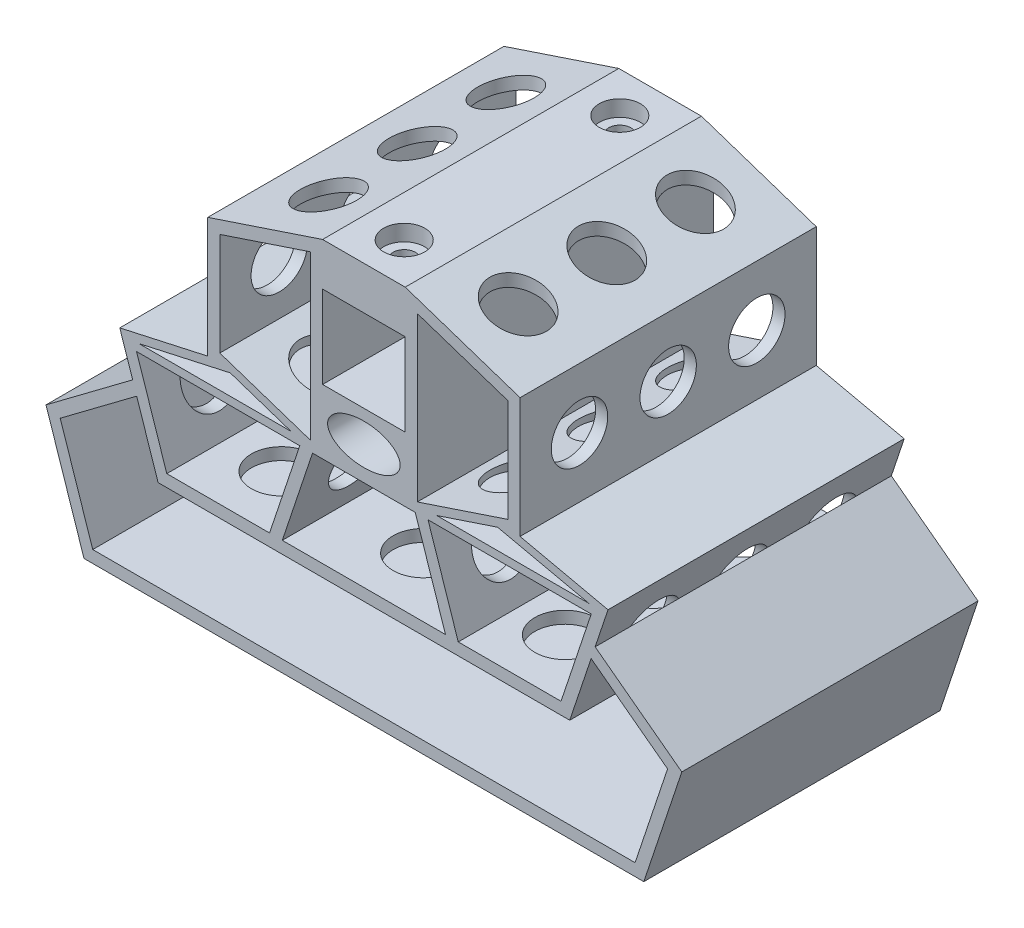
from build123d import *

# Parameters (mm, degrees)
SKETCH1_W                      = 20.5
SKETCH1_H                      = 20.5
BOSS_EXTRUDE1_DEPTH            = 73.5
CUT_EXTRUDE2_DEPTH             = 109.395522289
SKETCH3_RX                     = 9
SKETCH3_RY                     = 5
CUT_EXTRUDE4_DEPTH             = 109.395522289
CUT_EXTRUDE5_DEPTH             = 109.39552246
CUT_EXTRUDE5_DEPTH_BACK        = 109.39552246
SKETCH4_R                      = 7
SKETCH5_R                      = 7
CUT_EXTRUDE6_DEPTH             = 10
CUT_EXTRUDE7_START             = -10
SKETCH6_R                      = 7
CUT_EXTRUDE7_DEPTH             = 10
SKETCH7_R                      = 7.5
CUT_EXTRUDE8_DEPTH             = 10
SKETCH8_R                      = 7
CUT_EXTRUDE9_DEPTH             = 109.39552246
CUT_EXTRUDE9_DIRECTION_2_REACH = 110.396
SKETCH9_R                      = 2.75
CUT_EXTRUDE10_DEPTH            = 15
SKETCH10_R                     = 5.1
CUT_EXTRUDE11_DEPTH            = 4
BOSS_EXTRUDE2_REACH            = 110.396


with BuildPart() as part:
    # Sketch1 → Boss-Extrude1 (new body)
    with BuildSketch(Plane.XY):
        Polygon((60.57455532, -23.25), (51.07455532, -51.75), (-51.07455532, -51.75), (-60.57455532, -23.25), (-38.75, -18.41227766), (-38.75, 11.41227766), (-10.25, 20.91227766), (0, 20.91227766), (10.25, 20.91227766), (38.75, 11.41227766), (38.75, -18.41227766), align=None)
        Rectangle(SKETCH1_W, SKETCH1_H, mode=Mode.SUBTRACT)
        Polygon((-12.75, -26.25), (12.75, -26.25), (20.25, -48.75), (-20.25, -48.75), align=None, mode=Mode.SUBTRACT)
        Polygon((15.91227766, -26.25), (23.41227766, -48.75), (48.91227766, -48.75), (56.41227766, -26.25), align=None, mode=Mode.SUBTRACT)
        Polygon((-15.91227766, -26.25), (-56.41227766, -26.25), (-48.91227766, -48.75), (-23.41227766, -48.75), align=None, mode=Mode.SUBTRACT)
        Polygon((-13.25, -23.75), (-13.25, 16.75), (-35.75, 9.25), (-35.75, -16.25), align=None, mode=Mode.SUBTRACT)
        Polygon((35.75, 9.25), (35.75, -16.25), (13.25, -23.75), (13.25, 16.75), align=None, mode=Mode.SUBTRACT)
    extrude(amount=BOSS_EXTRUDE1_DEPTH)

    # Sketch2 → Cut-Extrude2 (cut, through all)
    with BuildSketch(Plane.XY):
        Polygon((-18.07455532, -24.25), (-55.844220457, -24.25), (-33.159635592, -19.221639909), align=None)
        Polygon((18.07455532, -24.25), (55.844220457, -24.25), (33.159635592, -19.221639909), align=None)
    extrude(amount=CUT_EXTRUDE2_DEPTH, mode=Mode.SUBTRACT)

    # Sketch3 → Cut-Extrude4 (cut, through all)
    with BuildSketch(Plane.XY):
        with Locations((0, -18)):
            Ellipse(SKETCH3_RX, SKETCH3_RY)
    extrude(amount=CUT_EXTRUDE4_DEPTH, mode=Mode.SUBTRACT)

    # Sketch4 → Cut-Extrude5 (cut, two sides: drawn at the far end of the back side and taken through both)
    with BuildSketch(Plane(origin=(0, 0, 0), x_dir=(0, 0, -1), z_dir=(1, 0, 0)).offset(-CUT_EXTRUDE5_DEPTH_BACK)):
        with Locations(Location((-36.75, -36.52, 0), (0, 0, 270))):
            Circle(SKETCH4_R)
        with Locations(Location((-58.75, -36.52, 0), (0, 0, 270))):
            Circle(SKETCH4_R)
        with Locations(Location((-14.75, -36.52, 0), (0, 0, 270))):
            Circle(SKETCH4_R)
    extrude(amount=CUT_EXTRUDE5_DEPTH + CUT_EXTRUDE5_DEPTH_BACK, mode=Mode.SUBTRACT)

    # Sketch5 → Cut-Extrude6 (cut)
    with BuildSketch(Plane(origin=(38.75, 0, 0), x_dir=(0, 0, -1), z_dir=(1, 0, 0))):
        with Locations(Location((-36.75, -3.5, 0), (0, 0, 90))):
            Circle(SKETCH5_R)
        with Locations(Location((-14.75, -3.5, 0), (0, 0, 90))):
            Circle(SKETCH5_R)
        with Locations(Location((-58.75, -3.5, 0), (0, 0, 90))):
            Circle(SKETCH5_R)
    extrude(amount=-CUT_EXTRUDE6_DEPTH, mode=Mode.SUBTRACT)

    # Sketch6 → Cut-Extrude7 (cut)
    with BuildSketch(Plane.ZY.offset(38.75).offset(CUT_EXTRUDE7_START)):
        with Locations(Location((36.75, -3.5, 0), (0, 0, 90))):
            Circle(SKETCH6_R)
        with Locations(Location((58.75, -3.5, 0), (0, 0, 90))):
            Circle(SKETCH6_R)
        with Locations(Location((14.75, -3.5, 0), (0, 0, 90))):
            Circle(SKETCH6_R)
    extrude(amount=CUT_EXTRUDE7_DEPTH, mode=Mode.SUBTRACT)

    # Sketch7 → Cut-Extrude8 (cut)
    with BuildSketch(Plane.XZ.offset(51.75)):
        with Locations((0, 36.75)):
            Circle(SKETCH7_R)
        with Locations((35.16, 36.75)):
            Circle(SKETCH7_R)
        with Locations((-35.16, 36.75)):
            Circle(SKETCH7_R)
        with Locations((0, 58.75)):
            Circle(SKETCH7_R)
        with Locations((35.16, 58.75)):
            Circle(SKETCH7_R)
        with Locations((-35.16, 58.75)):
            Circle(SKETCH7_R)
        with Locations((0, 14.75)):
            Circle(SKETCH7_R)
        with Locations((35.16, 14.75)):
            Circle(SKETCH7_R)
        with Locations((-35.16, 14.75)):
            Circle(SKETCH7_R)
    extrude(amount=-CUT_EXTRUDE8_DEPTH, mode=Mode.SUBTRACT)

    # Sketch8 → Cut-Extrude9 (cut)
    with BuildSketch(Plane(origin=(0, 0, 0), x_dir=(1, 0, 0), z_dir=(0, 1, 0))):
        with Locations(Location((23.52, -36.75, 0), (0, 0, 141.070586059))):
            Circle(SKETCH8_R)
        with Locations(Location((23.52, -14.75, 0), (0, 0, 141.070586059))):
            Circle(SKETCH8_R)
        with Locations(Location((23.52, -58.75, 0), (0, 0, 141.070586059))):
            Circle(SKETCH8_R)
        with Locations(Location((-23.52, -58.75, 0), (0, 0, 38.929413941))):
            Circle(SKETCH8_R)
        with Locations(Location((-23.52, -14.75, 0), (0, 0, 38.929413941))):
            Circle(SKETCH8_R)
        with Locations(Location((-23.52, -36.75, 0), (0, 0, 38.929413941))):
            Circle(SKETCH8_R)
    extrude(amount=CUT_EXTRUDE9_DEPTH, mode=Mode.SUBTRACT)

    # Cut-Extrude9 direction 2: up to this face of the body (flat: up to its plane)
    cut_extrude9_direction_2_end = Plane(part.part.faces().sort_by_distance((-36.959387889, -24.25, 36.75))[0])
    # Sketch8 → Cut-Extrude9 direction 2 (cut, up to the picked face)
    with BuildSketch(Plane(origin=(0, 0, 0), x_dir=(1, 0, 0), z_dir=(0, 1, 0)), mode=Mode.PRIVATE) as cut_extrude9_direction_2_sk1:
        with Locations(Location((23.52, -36.75, 0), (0, 0, 141.070586059))):
            Circle(SKETCH8_R)
    cut_extrude9_direction_2_tool1 = split(extrude(cut_extrude9_direction_2_sk1.sketch, amount=-CUT_EXTRUDE9_DIRECTION_2_REACH, mode=Mode.PRIVATE), bisect_by=cut_extrude9_direction_2_end, keep=Keep.BOTH, mode=Mode.PRIVATE)
    # Sketch8 → Cut-Extrude9 direction 2 (cut, up to the picked face)
    with BuildSketch(Plane(origin=(0, 0, 0), x_dir=(1, 0, 0), z_dir=(0, 1, 0)), mode=Mode.PRIVATE) as cut_extrude9_direction_2_sk2:
        with Locations(Location((23.52, -14.75, 0), (0, 0, 141.070586059))):
            Circle(SKETCH8_R)
    cut_extrude9_direction_2_tool2 = split(extrude(cut_extrude9_direction_2_sk2.sketch, amount=-CUT_EXTRUDE9_DIRECTION_2_REACH, mode=Mode.PRIVATE), bisect_by=cut_extrude9_direction_2_end, keep=Keep.BOTH, mode=Mode.PRIVATE)
    # Sketch8 → Cut-Extrude9 direction 2 (cut, up to the picked face)
    with BuildSketch(Plane(origin=(0, 0, 0), x_dir=(1, 0, 0), z_dir=(0, 1, 0)), mode=Mode.PRIVATE) as cut_extrude9_direction_2_sk3:
        with Locations(Location((23.52, -58.75, 0), (0, 0, 141.070586059))):
            Circle(SKETCH8_R)
    cut_extrude9_direction_2_tool3 = split(extrude(cut_extrude9_direction_2_sk3.sketch, amount=-CUT_EXTRUDE9_DIRECTION_2_REACH, mode=Mode.PRIVATE), bisect_by=cut_extrude9_direction_2_end, keep=Keep.BOTH, mode=Mode.PRIVATE)
    # Sketch8 → Cut-Extrude9 direction 2 (cut, up to the picked face)
    with BuildSketch(Plane(origin=(0, 0, 0), x_dir=(1, 0, 0), z_dir=(0, 1, 0)), mode=Mode.PRIVATE) as cut_extrude9_direction_2_sk4:
        with Locations(Location((-23.52, -58.75, 0), (0, 0, 38.929413941))):
            Circle(SKETCH8_R)
    cut_extrude9_direction_2_tool4 = split(extrude(cut_extrude9_direction_2_sk4.sketch, amount=-CUT_EXTRUDE9_DIRECTION_2_REACH, mode=Mode.PRIVATE), bisect_by=cut_extrude9_direction_2_end, keep=Keep.BOTH, mode=Mode.PRIVATE)
    # Sketch8 → Cut-Extrude9 direction 2 (cut, up to the picked face)
    with BuildSketch(Plane(origin=(0, 0, 0), x_dir=(1, 0, 0), z_dir=(0, 1, 0)), mode=Mode.PRIVATE) as cut_extrude9_direction_2_sk5:
        with Locations(Location((-23.52, -14.75, 0), (0, 0, 38.929413941))):
            Circle(SKETCH8_R)
    cut_extrude9_direction_2_tool5 = split(extrude(cut_extrude9_direction_2_sk5.sketch, amount=-CUT_EXTRUDE9_DIRECTION_2_REACH, mode=Mode.PRIVATE), bisect_by=cut_extrude9_direction_2_end, keep=Keep.BOTH, mode=Mode.PRIVATE)
    # Sketch8 → Cut-Extrude9 direction 2 (cut, up to the picked face)
    with BuildSketch(Plane(origin=(0, 0, 0), x_dir=(1, 0, 0), z_dir=(0, 1, 0)), mode=Mode.PRIVATE) as cut_extrude9_direction_2_sk6:
        with Locations(Location((-23.52, -36.75, 0), (0, 0, 38.929413941))):
            Circle(SKETCH8_R)
    cut_extrude9_direction_2_tool6 = split(extrude(cut_extrude9_direction_2_sk6.sketch, amount=-CUT_EXTRUDE9_DIRECTION_2_REACH, mode=Mode.PRIVATE), bisect_by=cut_extrude9_direction_2_end, keep=Keep.BOTH, mode=Mode.PRIVATE)
    add(cut_extrude9_direction_2_tool1.solids().sort_by(Axis((23.52, 0, 36.75), (0, -1, 0)))[0], mode=Mode.SUBTRACT)
    add(cut_extrude9_direction_2_tool2.solids().sort_by(Axis((23.52, 0, 14.75), (0, -1, 0)))[0], mode=Mode.SUBTRACT)
    add(cut_extrude9_direction_2_tool3.solids().sort_by(Axis((23.52, 0, 58.75), (0, -1, 0)))[0], mode=Mode.SUBTRACT)
    add(cut_extrude9_direction_2_tool4.solids().sort_by(Axis((-23.52, 0, 58.75), (0, -1, 0)))[0], mode=Mode.SUBTRACT)
    add(cut_extrude9_direction_2_tool5.solids().sort_by(Axis((-23.52, 0, 14.75), (0, -1, 0)))[0], mode=Mode.SUBTRACT)
    add(cut_extrude9_direction_2_tool6.solids().sort_by(Axis((-23.52, 0, 36.75), (0, -1, 0)))[0], mode=Mode.SUBTRACT)

    # Sketch9 → Cut-Extrude10 (cut)
    with BuildSketch(Plane(origin=(0, 20.91227766, 0), x_dir=(1, 0, 0), z_dir=(0, 1, 0))):
        with Locations(Location((0, -10, 0), (0, 0, 180))):
            Circle(SKETCH9_R)
        with Locations((0, -63.5)):
            Circle(SKETCH9_R)
    extrude(amount=-CUT_EXTRUDE10_DEPTH, mode=Mode.SUBTRACT)

    # Sketch10 → Cut-Extrude11 (cut)
    with BuildSketch(Plane(origin=(0, 20.91227766, 0), x_dir=(1, 0, 0), z_dir=(0, 1, 0))):
        with Locations(Location((0, -10, 0), (0, 0, 180))):
            Circle(SKETCH10_R)
        with Locations(Location((0, -63.5, 0), (0, 0, 180))):
            Circle(SKETCH10_R)
    extrude(amount=-CUT_EXTRUDE11_DEPTH, mode=Mode.SUBTRACT)

    # Boss-Extrude2: up to this face of the body (flat: up to its plane)
    boss_extrude2_end = Plane(part.part.faces().sort_by_distance((54.484360472, -37.053268384, 73.5))[0])
    # Sketch11 → Boss-Extrude2 (add, up to the picked face)
    with BuildSketch(Plane.XY, mode=Mode.PRIVATE) as boss_extrude2_sk1:
        Polygon((-20.25, -74.25), (20.25, -74.25), (67.291637772, -74.25), (75.355445805, -50.0585759), (56.381779844, -35.828326429), (57.381779844, -32.828326429), (78.885267933, -48.955942496), (69.453915432, -77.25), (-69.453915432, -77.25), (-78.885267933, -48.955942496), (-57.381779844, -32.828326429), (-56.381779844, -35.828326429), (-75.355445805, -50.0585759), (-67.291637772, -74.25), align=None)
    boss_extrude2_tool1 = split(extrude(boss_extrude2_sk1.sketch, amount=BOSS_EXTRUDE2_REACH, mode=Mode.PRIVATE), bisect_by=boss_extrude2_end, keep=Keep.BOTH, mode=Mode.PRIVATE)
    add(boss_extrude2_tool1.solids().sort_by(Axis((0, -75.889049, 0), (0, 0, 1)))[0])


solid = part.part
